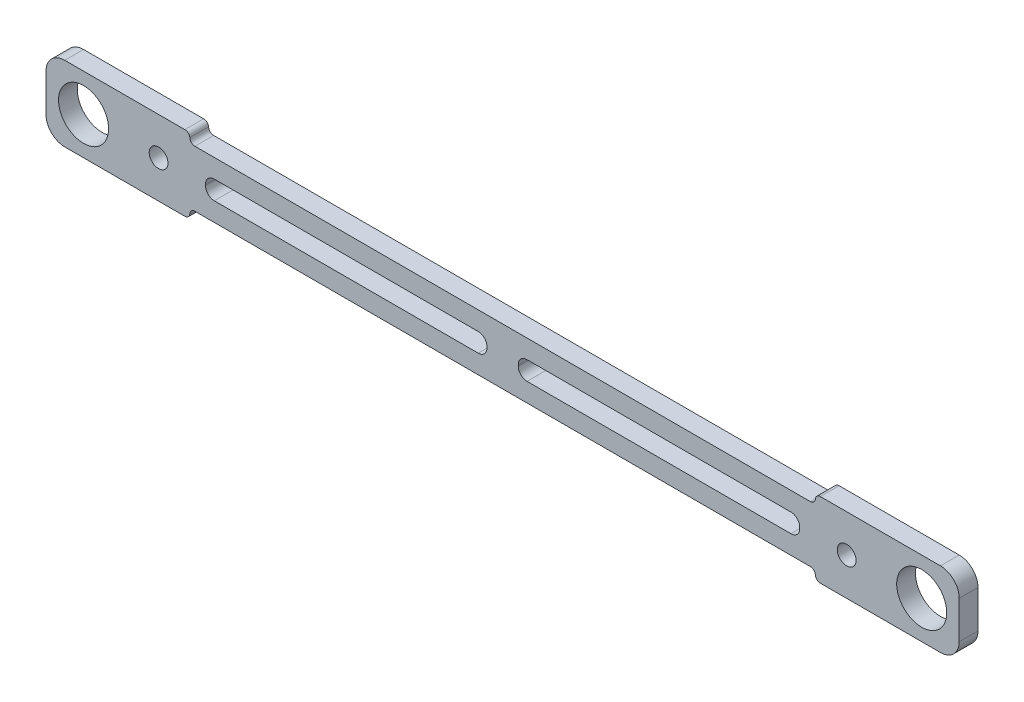
from build123d import *

# Parameters (mm, degrees)
SKETCH1_R           = 1.5
SKETCH1_R_2         = 4
BOSS_EXTRUDE1_DEPTH = 3


with BuildPart() as part:
    # Sketch1 → Boss-Extrude1 (new body)
    with BuildSketch(Plane.XY):
        with BuildLine():
            Line((-49.2, 4.5), (49.2, 4.5))
            ThreePointArc((49.2, 4.5), (49.765685425, 4.734314575), (50, 5.3))
            Line((50, 5.3), (50, 5.2))
            ThreePointArc((50, 5.2), (50.234314575, 5.765685425), (50.8, 6))
            Line((50.8, 6), (70, 6))
            ThreePointArc((70, 6), (72.121320344, 5.121320344), (73, 3))
            Line((73, 3), (73, -3))
            ThreePointArc((73, -3), (72.121320344, -5.121320344), (70, -6))
            Line((70, -6), (50.8, -6))
            ThreePointArc((50.8, -6), (50.234314575, -5.765685425), (50, -5.2))
            Line((50, -5.2), (50, -5.3))
            ThreePointArc((50, -5.3), (49.765685425, -4.734314575), (49.2, -4.5))
            Line((49.2, -4.5), (-49.2, -4.5))
            ThreePointArc((-49.2, -4.5), (-49.765685425, -4.734314575), (-50, -5.3))
            Line((-50, -5.3), (-50, -5.2))
            ThreePointArc((-50, -5.2), (-50.234314575, -5.765685425), (-50.8, -6))
            Line((-50.8, -6), (-70, -6))
            ThreePointArc((-70, -6), (-72.121320344, -5.121320344), (-73, -3))
            Line((-73, -3), (-73, 3))
            ThreePointArc((-73, 3), (-72.121320344, 5.121320344), (-70, 6))
            Line((-70, 6), (-50.8, 6))
            ThreePointArc((-50.8, 6), (-50.234314575, 5.765685425), (-50, 5.2))
            Line((-50, 5.2), (-50, 5.3))
            ThreePointArc((-50, 5.3), (-49.765685425, 4.734314575), (-49.2, 4.5))
        make_face()
        with Locations((-55, 0)):
            Circle(SKETCH1_R, mode=Mode.SUBTRACT)
        with Locations((-67, 0)):
            Circle(SKETCH1_R_2, mode=Mode.SUBTRACT)
        with Locations((67, 0)):
            Circle(SKETCH1_R_2, mode=Mode.SUBTRACT)
        with Locations((55, 0)):
            Circle(SKETCH1_R, mode=Mode.SUBTRACT)
        with BuildLine():
            Line((-46.1, 1.5), (-3.9, 1.5))
            ThreePointArc((-3.9, 1.5), (-2.910050506, 1.089949494), (-2.5, 0.1))
            Line((-2.5, 0.1), (-2.5, -0.1))
            ThreePointArc((-2.5, -0.1), (-2.910050506, -1.089949494), (-3.9, -1.5))
            Line((-3.9, -1.5), (-46.1, -1.5))
            ThreePointArc((-46.1, -1.5), (-47.089949494, -1.089949494), (-47.5, -0.1))
            Line((-47.5, -0.1), (-47.5, 0.1))
            ThreePointArc((-47.5, 0.1), (-47.089949494, 1.089949494), (-46.1, 1.5))
        make_face(mode=Mode.SUBTRACT)
        with BuildLine():
            Line((46.1, 1.5), (3.9, 1.5))
            ThreePointArc((3.9, 1.5), (2.910050506, 1.089949494), (2.5, 0.1))
            Line((2.5, 0.1), (2.5, -0.1))
            ThreePointArc((2.5, -0.1), (2.910050506, -1.089949494), (3.9, -1.5))
            Line((3.9, -1.5), (46.1, -1.5))
            ThreePointArc((46.1, -1.5), (47.089949494, -1.089949494), (47.5, -0.1))
            Line((47.5, -0.1), (47.5, 0.1))
            ThreePointArc((47.5, 0.1), (47.089949494, 1.089949494), (46.1, 1.5))
        make_face(mode=Mode.SUBTRACT)
    extrude(amount=BOSS_EXTRUDE1_DEPTH)


solid = part.part
